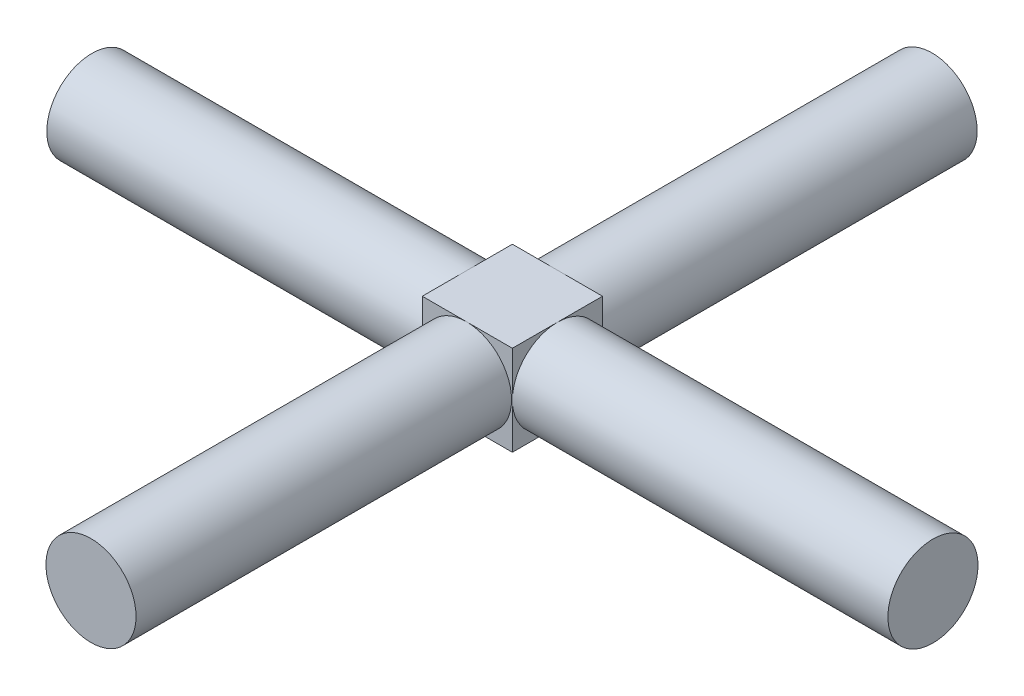
from build123d import *

# Parameters (mm, degrees)
SKETCH1_W           = 1.5
SKETCH1_H           = 1.5
BOSS_EXTRUDE1_DEPTH = 1.5
SKETCH3_R           = 0.75
BOSS_EXTRUDE2_DEPTH = 7
SKETCH4_R           = 0.75
BOSS_EXTRUDE3_DEPTH = 7


with BuildPart() as part:
    # Sketch1 → Boss-Extrude1 (new body)
    with BuildSketch(Plane(origin=(0, 0, 0), x_dir=(1, 0, 0), z_dir=(0, 1, 0))):
        Rectangle(SKETCH1_W, SKETCH1_H)
    extrude(amount=BOSS_EXTRUDE1_DEPTH)

    # Sketch3 → Boss-Extrude2 (add, symmetric)
    with BuildSketch(Plane(origin=(0, 0, 0), x_dir=(0, 0, -1), z_dir=(1, 0, 0))):
        with Locations((0, 0.75)):
            Circle(SKETCH3_R)
    extrude(amount=BOSS_EXTRUDE2_DEPTH, both=True)

    # Sketch4 → Boss-Extrude3 (add, symmetric)
    with BuildSketch(Plane.XY):
        with Locations(Location((-0.013990229, 0.75, 0), (0, 0, 191.084007893))):
            Circle(SKETCH4_R)
    extrude(amount=BOSS_EXTRUDE3_DEPTH, both=True)


solid = part.part
